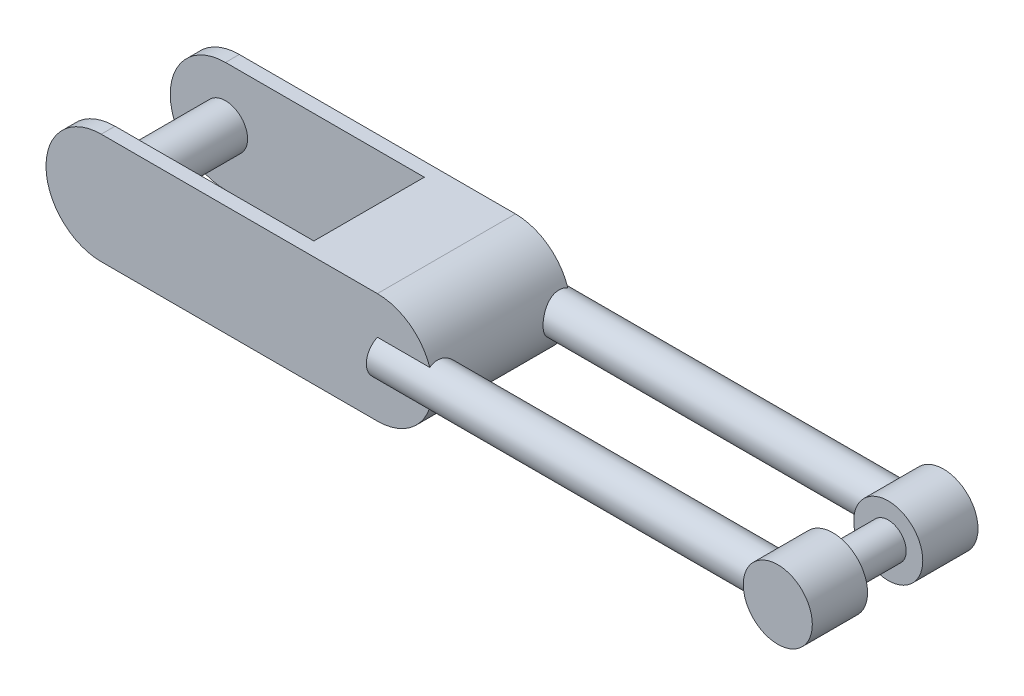
from build123d import *

# Parameters (mm, degrees)
EXTRUDE1_DEPTH     = 12.5
SKETCH2_W          = 50
SKETCH2_H          = 20
CUT_EXTRUDE1_DEPTH = 65.468984791
SKETCH3_R          = 3.5
EXTRUDE2_DEPTH     = 70
SKETCH4_R          = 6.25
EXTRUDE3_DEPTH     = 15
SKETCH7_R          = 6.25
SKETCH7_R_2        = 3.25
EXTRUDE6_DEPTH     = 5
SKETCH6_R          = 4
EXTRUDE5_DEPTH     = 20


with BuildPart() as part:
    # Sketch1 → Extrude1 (new, symmetric)
    with BuildSketch(Plane.XY):
        with BuildLine():
            Line((50, 10), (0, 10))
            ThreePointArc((0, 10), (-10, 0), (0, -10))
            Line((0, -10), (50, -10))
            ThreePointArc((50, -10), (60, 0), (50, 10))
        make_face()
    extrude(amount=EXTRUDE1_DEPTH, both=True)

    # Sketch2 → Cut-Extrude1 (cut, through all)
    with BuildSketch(Plane(origin=(0, 10, 0), x_dir=(-1, 0, 0), z_dir=(0, 1, 0))):
        with Locations((-11, 0)):
            Rectangle(SKETCH2_W, SKETCH2_H)
    extrude(amount=-CUT_EXTRUDE1_DEPTH, mode=Mode.SUBTRACT)

    # Sketch3 → Extrude2 (add)
    with BuildSketch(Plane.YZ.offset(50)):
        with Locations(Location((0, 11, 0), (0, 0, 154.623066475))):
            Circle(SKETCH3_R)
    extrude2 = extrude(amount=EXTRUDE2_DEPTH)

    # Mirror1: Extrude2 across plane
    add(extrude2.mirror(Plane.XY))

    # Sketch4 → Extrude3 (add, symmetric)
    with BuildSketch(Plane.XY):
        with Locations((125, 0)):
            Circle(SKETCH4_R)
    extrude(amount=EXTRUDE3_DEPTH, both=True)

    # Sketch7 → Extrude6 (cut, symmetric)
    with BuildSketch(Plane.XY):
        with Locations((125, 0)):
            Circle(SKETCH7_R)
        with Locations((125, 0)):
            Circle(SKETCH7_R_2, mode=Mode.SUBTRACT)
    extrude(amount=EXTRUDE6_DEPTH, both=True, mode=Mode.SUBTRACT)

    # Sketch6 → Extrude5 (add)
    with BuildSketch(Plane.XY.offset(-10)):
        with Locations(Location((0, 0, 0), (0, 0, 180))):
            Circle(SKETCH6_R)
    extrude(amount=EXTRUDE5_DEPTH)


solid = part.part
